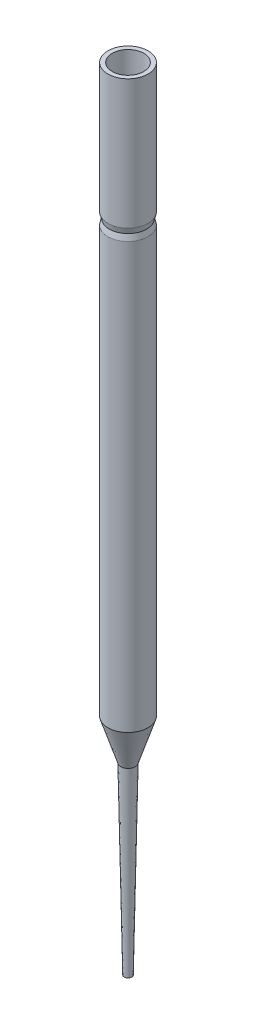
from build123d import *


with BuildPart() as part:
    # Skizze1 → Rotation1 (revolve)
    with BuildSketch(Plane.XY, mode=Mode.PRIVATE) as rotation1_sk:
        Polygon((-2.75, 0), (-2.75, -22.5), (-2.5, -23.5), (-2.75, -24.5), (-2.75, -98.5), (-1, -105.5), (-0.4, -137.5), (-0.65, -137.5), (-1.25, -105.5), (-3.5, -98.5), (-3.5, -24.5), (-3.25, -23.5), (-3.5, -22.5), (-3.5, 0), align=None)
    revolve(rotation1_sk.sketch.rotate(Axis((0, 0, 0), (0, 1, 0)), 270), axis=Axis((0, 0, 0), (0, 1, 0)))


solid = part.part
